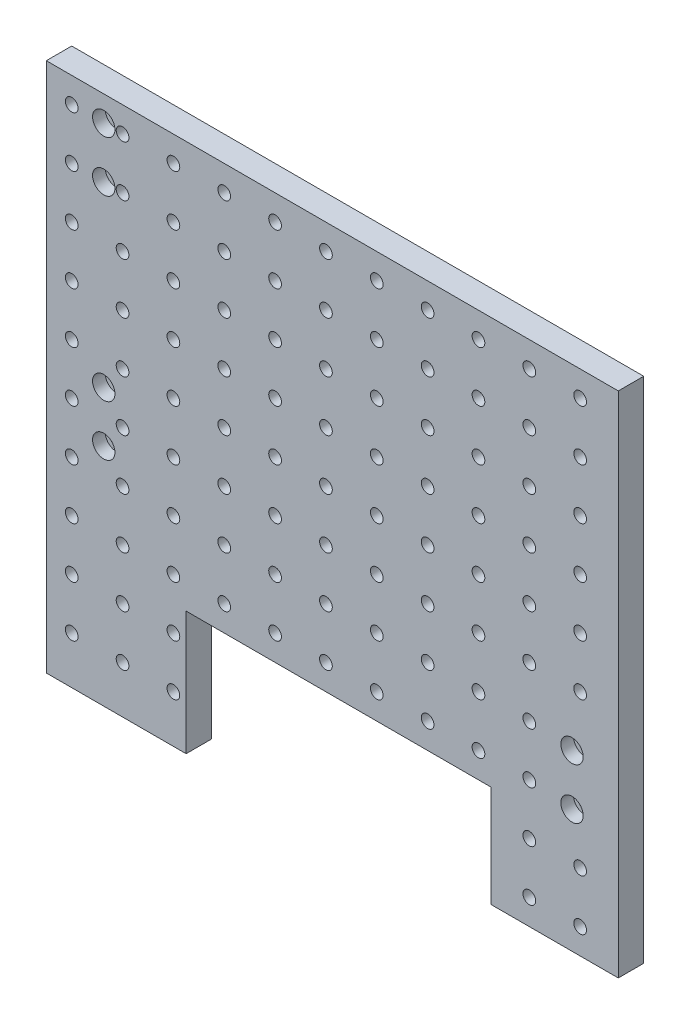
from build123d import *

# Parameters (mm, degrees)
SKETCH1_R           = 3.175
BOSS_EXTRUDE2_DEPTH = 12.7
SKETCH2_R           = 3.429
CUT_EXTRUDE1_DEPTH  = 12.7
SKETCH2_3_R         = 5.588
SKETCH2_3_R_2       = 3.429
CUT_EXTRUDE2_DEPTH  = 6.35
SKETCH2_6_R         = 3.429
CUT_EXTRUDE6_DEPTH  = 12.7
SKETCH2_7_R         = 3.429
CUT_EXTRUDE7_DEPTH  = 12.7
SKETCH2_8_R         = 5.588
SKETCH2_8_R_2       = 3.429
CUT_EXTRUDE8_DEPTH  = 6.35


with BuildPart() as part:
    # Sketch1 → Boss-Extrude2 (new body)
    with BuildSketch(Plane.XY):
        Polygon((69.85, 0), (222.25, 0), (222.25, -50.8), (285.75, -50.8), (285.75, 0), (285.75, 203.2), (0, 203.2), (0, 0), (0, -61.722), (69.85, -61.722), align=None)
        with Locations((12.7, 190.5)):
            Circle(SKETCH1_R, mode=Mode.SUBTRACT)
        with Locations((38.1, 190.5)):
            Circle(SKETCH1_R, mode=Mode.SUBTRACT)
        with Locations((63.5, 190.5)):
            Circle(SKETCH1_R, mode=Mode.SUBTRACT)
        with Locations((88.9, 190.5)):
            Circle(SKETCH1_R, mode=Mode.SUBTRACT)
        with Locations((114.3, 190.5)):
            Circle(SKETCH1_R, mode=Mode.SUBTRACT)
        with Locations((139.7, 190.5)):
            Circle(SKETCH1_R, mode=Mode.SUBTRACT)
        with Locations((165.1, 190.5)):
            Circle(SKETCH1_R, mode=Mode.SUBTRACT)
        with Locations((190.5, 190.5)):
            Circle(SKETCH1_R, mode=Mode.SUBTRACT)
        with Locations((215.9, 190.5)):
            Circle(SKETCH1_R, mode=Mode.SUBTRACT)
        with Locations((241.3, 190.5)):
            Circle(SKETCH1_R, mode=Mode.SUBTRACT)
        with Locations((266.7, 190.5)):
            Circle(SKETCH1_R, mode=Mode.SUBTRACT)
        with Locations((38.1, 165.1)):
            Circle(SKETCH1_R, mode=Mode.SUBTRACT)
        with Locations((63.5, 165.1)):
            Circle(SKETCH1_R, mode=Mode.SUBTRACT)
        with Locations((88.9, 165.1)):
            Circle(SKETCH1_R, mode=Mode.SUBTRACT)
        with Locations((114.3, 165.1)):
            Circle(SKETCH1_R, mode=Mode.SUBTRACT)
        with Locations((139.7, 165.1)):
            Circle(SKETCH1_R, mode=Mode.SUBTRACT)
        with Locations((165.1, 165.1)):
            Circle(SKETCH1_R, mode=Mode.SUBTRACT)
        with Locations((190.5, 165.1)):
            Circle(SKETCH1_R, mode=Mode.SUBTRACT)
        with Locations((215.9, 165.1)):
            Circle(SKETCH1_R, mode=Mode.SUBTRACT)
        with Locations((241.3, 165.1)):
            Circle(SKETCH1_R, mode=Mode.SUBTRACT)
        with Locations((266.7, 165.1)):
            Circle(SKETCH1_R, mode=Mode.SUBTRACT)
        with Locations((38.1, 139.7)):
            Circle(SKETCH1_R, mode=Mode.SUBTRACT)
        with Locations((63.5, 139.7)):
            Circle(SKETCH1_R, mode=Mode.SUBTRACT)
        with Locations((88.9, 139.7)):
            Circle(SKETCH1_R, mode=Mode.SUBTRACT)
        with Locations((114.3, 139.7)):
            Circle(SKETCH1_R, mode=Mode.SUBTRACT)
        with Locations((139.7, 139.7)):
            Circle(SKETCH1_R, mode=Mode.SUBTRACT)
        with Locations((165.1, 139.7)):
            Circle(SKETCH1_R, mode=Mode.SUBTRACT)
        with Locations((190.5, 139.7)):
            Circle(SKETCH1_R, mode=Mode.SUBTRACT)
        with Locations((215.9, 139.7)):
            Circle(SKETCH1_R, mode=Mode.SUBTRACT)
        with Locations((241.3, 139.7)):
            Circle(SKETCH1_R, mode=Mode.SUBTRACT)
        with Locations((266.7, 139.7)):
            Circle(SKETCH1_R, mode=Mode.SUBTRACT)
        with Locations((38.1, 114.3)):
            Circle(SKETCH1_R, mode=Mode.SUBTRACT)
        with Locations((63.5, 114.3)):
            Circle(SKETCH1_R, mode=Mode.SUBTRACT)
        with Locations((88.9, 114.3)):
            Circle(SKETCH1_R, mode=Mode.SUBTRACT)
        with Locations((114.3, 114.3)):
            Circle(SKETCH1_R, mode=Mode.SUBTRACT)
        with Locations((139.7, 114.3)):
            Circle(SKETCH1_R, mode=Mode.SUBTRACT)
        with Locations((165.1, 114.3)):
            Circle(SKETCH1_R, mode=Mode.SUBTRACT)
        with Locations((190.5, 114.3)):
            Circle(SKETCH1_R, mode=Mode.SUBTRACT)
        with Locations((215.9, 114.3)):
            Circle(SKETCH1_R, mode=Mode.SUBTRACT)
        with Locations((241.3, 114.3)):
            Circle(SKETCH1_R, mode=Mode.SUBTRACT)
        with Locations((266.7, 114.3)):
            Circle(SKETCH1_R, mode=Mode.SUBTRACT)
        with Locations((38.1, 88.9)):
            Circle(SKETCH1_R, mode=Mode.SUBTRACT)
        with Locations((63.5, 88.9)):
            Circle(SKETCH1_R, mode=Mode.SUBTRACT)
        with Locations((88.9, 88.9)):
            Circle(SKETCH1_R, mode=Mode.SUBTRACT)
        with Locations((114.3, 88.9)):
            Circle(SKETCH1_R, mode=Mode.SUBTRACT)
        with Locations((139.7, 88.9)):
            Circle(SKETCH1_R, mode=Mode.SUBTRACT)
        with Locations((165.1, 88.9)):
            Circle(SKETCH1_R, mode=Mode.SUBTRACT)
        with Locations((190.5, 88.9)):
            Circle(SKETCH1_R, mode=Mode.SUBTRACT)
        with Locations((215.9, 88.9)):
            Circle(SKETCH1_R, mode=Mode.SUBTRACT)
        with Locations((241.3, 88.9)):
            Circle(SKETCH1_R, mode=Mode.SUBTRACT)
        with Locations((266.7, 88.9)):
            Circle(SKETCH1_R, mode=Mode.SUBTRACT)
        with Locations((38.1, 63.5)):
            Circle(SKETCH1_R, mode=Mode.SUBTRACT)
        with Locations((63.5, 63.5)):
            Circle(SKETCH1_R, mode=Mode.SUBTRACT)
        with Locations((88.9, 63.5)):
            Circle(SKETCH1_R, mode=Mode.SUBTRACT)
        with Locations((114.3, 63.5)):
            Circle(SKETCH1_R, mode=Mode.SUBTRACT)
        with Locations((139.7, 63.5)):
            Circle(SKETCH1_R, mode=Mode.SUBTRACT)
        with Locations((165.1, 63.5)):
            Circle(SKETCH1_R, mode=Mode.SUBTRACT)
        with Locations((190.5, 63.5)):
            Circle(SKETCH1_R, mode=Mode.SUBTRACT)
        with Locations((215.9, 63.5)):
            Circle(SKETCH1_R, mode=Mode.SUBTRACT)
        with Locations((241.3, 63.5)):
            Circle(SKETCH1_R, mode=Mode.SUBTRACT)
        with Locations((266.7, 63.5)):
            Circle(SKETCH1_R, mode=Mode.SUBTRACT)
        with Locations((38.1, 38.1)):
            Circle(SKETCH1_R, mode=Mode.SUBTRACT)
        with Locations((63.5, 38.1)):
            Circle(SKETCH1_R, mode=Mode.SUBTRACT)
        with Locations((88.9, 38.1)):
            Circle(SKETCH1_R, mode=Mode.SUBTRACT)
        with Locations((114.3, 38.1)):
            Circle(SKETCH1_R, mode=Mode.SUBTRACT)
        with Locations((139.7, 38.1)):
            Circle(SKETCH1_R, mode=Mode.SUBTRACT)
        with Locations((165.1, 38.1)):
            Circle(SKETCH1_R, mode=Mode.SUBTRACT)
        with Locations((190.5, 38.1)):
            Circle(SKETCH1_R, mode=Mode.SUBTRACT)
        with Locations((215.9, 38.1)):
            Circle(SKETCH1_R, mode=Mode.SUBTRACT)
        with Locations((241.3, 38.1)):
            Circle(SKETCH1_R, mode=Mode.SUBTRACT)
        with Locations((38.1, 12.7)):
            Circle(SKETCH1_R, mode=Mode.SUBTRACT)
        with Locations((63.5, 12.7)):
            Circle(SKETCH1_R, mode=Mode.SUBTRACT)
        with Locations((88.9, 12.7)):
            Circle(SKETCH1_R, mode=Mode.SUBTRACT)
        with Locations((114.3, 12.7)):
            Circle(SKETCH1_R, mode=Mode.SUBTRACT)
        with Locations((139.7, 12.7)):
            Circle(SKETCH1_R, mode=Mode.SUBTRACT)
        with Locations((165.1, 12.7)):
            Circle(SKETCH1_R, mode=Mode.SUBTRACT)
        with Locations((190.5, 12.7)):
            Circle(SKETCH1_R, mode=Mode.SUBTRACT)
        with Locations((215.9, 12.7)):
            Circle(SKETCH1_R, mode=Mode.SUBTRACT)
        with Locations((241.3, 12.7)):
            Circle(SKETCH1_R, mode=Mode.SUBTRACT)
        with Locations((38.1, -12.7)):
            Circle(SKETCH1_R, mode=Mode.SUBTRACT)
        with Locations((63.5, -12.7)):
            Circle(SKETCH1_R, mode=Mode.SUBTRACT)
        with Locations((241.3, -12.7)):
            Circle(SKETCH1_R, mode=Mode.SUBTRACT)
        with Locations((266.7, -12.7)):
            Circle(SKETCH1_R, mode=Mode.SUBTRACT)
        with Locations((38.1, -38.1)):
            Circle(SKETCH1_R, mode=Mode.SUBTRACT)
        with Locations((63.5, -38.1)):
            Circle(SKETCH1_R, mode=Mode.SUBTRACT)
        with Locations((241.3, -38.1)):
            Circle(SKETCH1_R, mode=Mode.SUBTRACT)
        with Locations((266.7, -38.1)):
            Circle(SKETCH1_R, mode=Mode.SUBTRACT)
        with Locations((12.7, 165.1)):
            Circle(SKETCH1_R, mode=Mode.SUBTRACT)
        with Locations((12.7, 139.7)):
            Circle(SKETCH1_R, mode=Mode.SUBTRACT)
        with Locations((12.7, 114.3)):
            Circle(SKETCH1_R, mode=Mode.SUBTRACT)
        with Locations((12.7, 88.9)):
            Circle(SKETCH1_R, mode=Mode.SUBTRACT)
        with Locations((12.7, 63.5)):
            Circle(SKETCH1_R, mode=Mode.SUBTRACT)
        with Locations((12.7, 38.1)):
            Circle(SKETCH1_R, mode=Mode.SUBTRACT)
        with Locations((12.7, 12.7)):
            Circle(SKETCH1_R, mode=Mode.SUBTRACT)
        with Locations((12.7, -12.7)):
            Circle(SKETCH1_R, mode=Mode.SUBTRACT)
        with Locations((12.7, -38.1)):
            Circle(SKETCH1_R, mode=Mode.SUBTRACT)
    extrude(amount=BOSS_EXTRUDE2_DEPTH)

    # Sketch2 → Cut-Extrude1 (cut)
    with BuildSketch(Plane.XY.offset(12.7)):
        with Locations((28.702, 76.2)):
            Circle(SKETCH2_R)
        with Locations((28.702, 50.8)):
            Circle(SKETCH2_R)
    extrude(amount=-CUT_EXTRUDE1_DEPTH, mode=Mode.SUBTRACT)

    # Sketch2<3> → Cut-Extrude2 (cut)
    # profile 1 of 4: a face of its own
    with BuildSketch(Plane.XY.offset(12.7)):
        with Locations((28.702, 76.2)):
            Circle(SKETCH2_3_R)
    # profile 2 of 4: a face of its own
    with BuildSketch(Plane.XY.offset(12.7)):
        with Locations((28.702, 50.8)):
            Circle(SKETCH2_3_R)
    # profile 3 of 4: a face of its own
    with BuildSketch(Plane.XY.offset(12.7)):
        with Locations((262.636, 10.668)):
            Circle(SKETCH2_3_R)
        with Locations((262.636, 10.668)):
            Circle(SKETCH2_3_R_2, mode=Mode.SUBTRACT)
    # profile 4 of 4: a face of its own
    with BuildSketch(Plane.XY.offset(12.7)):
        with Locations((262.636, 36.068)):
            Circle(SKETCH2_3_R)
        with Locations((262.636, 36.068)):
            Circle(SKETCH2_3_R_2, mode=Mode.SUBTRACT)
    extrude(amount=-CUT_EXTRUDE2_DEPTH, mode=Mode.SUBTRACT)

    # Sketch2<6> → Cut-Extrude6 (cut)
    with BuildSketch(Plane.XY.offset(12.7)):
        with Locations((262.636, 10.668)):
            Circle(SKETCH2_6_R)
        with Locations((262.636, 36.068)):
            Circle(SKETCH2_6_R)
    extrude(amount=-CUT_EXTRUDE6_DEPTH, mode=Mode.SUBTRACT)

    # Sketch2<7> → Cut-Extrude7 (cut)
    with BuildSketch(Plane.XY.offset(12.7)):
        with Locations((28.702, 165.1)):
            Circle(SKETCH2_7_R)
        with Locations((28.702, 190.5)):
            Circle(SKETCH2_7_R)
    extrude(amount=-CUT_EXTRUDE7_DEPTH, mode=Mode.SUBTRACT)

    # Sketch2<8> → Cut-Extrude8 (cut)
    # profile 1 of 2: a face of its own
    with BuildSketch(Plane.XY.offset(12.7)):
        with Locations((28.702, 165.1)):
            Circle(SKETCH2_8_R)
        with Locations((28.702, 165.1)):
            Circle(SKETCH2_8_R_2, mode=Mode.SUBTRACT)
    # profile 2 of 2: a face of its own
    with BuildSketch(Plane.XY.offset(12.7)):
        with Locations((28.702, 190.5)):
            Circle(SKETCH2_8_R)
    extrude(amount=-CUT_EXTRUDE8_DEPTH, mode=Mode.SUBTRACT)


solid = part.part
